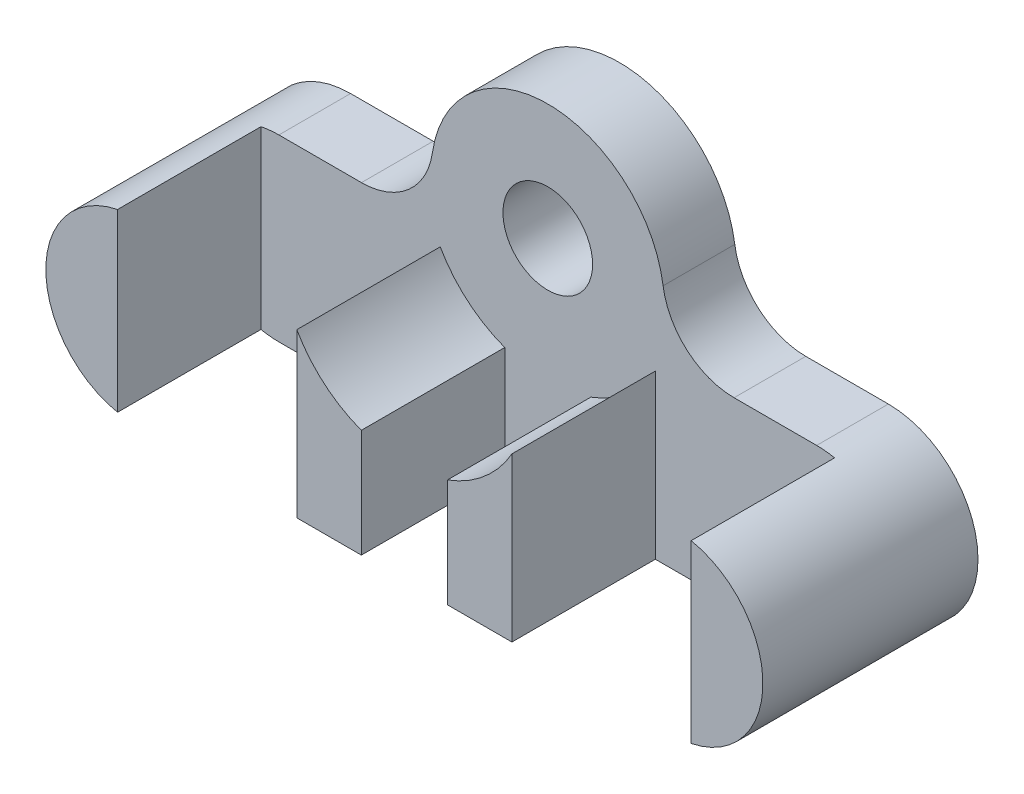
from build123d import *

# Parameters (mm, degrees)
SKETCH1_R           = 1.25
BOSS_EXTRUDE1_DEPTH = 2
BOSS_EXTRUDE2_DEPTH = 4
FILLET1_R           = 2
SKETCH3_W           = 2.4
SKETCH3_H           = 3.015421202
CUT_EXTRUDE1_DEPTH  = 4


with BuildPart() as part:
    # Sketch1 → Boss-Extrude1 (new body)
    with BuildSketch(Plane.XY):
        with BuildLine():
            Line((-7.5, -1.25), (-3, -1.25))
            ThreePointArc((-3, -1.25), (0, 3.25), (3, -1.25))
            Line((3, -1.25), (7.5, -1.25))
            ThreePointArc((7.5, -1.25), (10, -3.75), (7.5, -6.25))
            Line((7.5, -6.25), (-7.5, -6.25))
            ThreePointArc((-7.5, -6.25), (-10, -3.75), (-7.5, -1.25))
        make_face()
        Circle(SKETCH1_R, mode=Mode.SUBTRACT)
    extrude(amount=BOSS_EXTRUDE1_DEPTH)

    # Sketch2 → Boss-Extrude2 (add)
    with BuildSketch(Plane.XY.offset(2)):
        with BuildLine():
            Line((-8, -6.199489743), (-8, -1.300510257))
            ThreePointArc((-8, -1.300510257), (-10, -3.75), (-8, -6.199489743))
        make_face()
        with BuildLine():
            ThreePointArc((3, -1.703672504), (0, -3.45), (-3, -1.703672504))
            Line((-3, -1.703672504), (-3, -6.25))
            Line((-3, -6.25), (3, -6.25))
            Line((3, -6.25), (3, -1.703672504))
        make_face()
        with BuildLine():
            ThreePointArc((8, -6.199489743), (10, -3.75), (8, -1.300510257))
            Line((8, -1.300510257), (8, -6.199489743))
        make_face()
    extrude(amount=BOSS_EXTRUDE2_DEPTH)

    # Fillet1
    fillet1_edges = [part.edges().sort_by_distance(p)[0] for p in [
        (3, -1.25, 1),
        (-3, -1.25, 1),
    ]]
    fillet(fillet1_edges, radius=FILLET1_R)

    # Sketch3 → Cut-Extrude1 (cut)
    with BuildSketch(Plane.XY.offset(6)):
        with Locations((0, -4.742289399)):
            Rectangle(SKETCH3_W, SKETCH3_H)
    extrude(amount=-CUT_EXTRUDE1_DEPTH, mode=Mode.SUBTRACT)


solid = part.part
